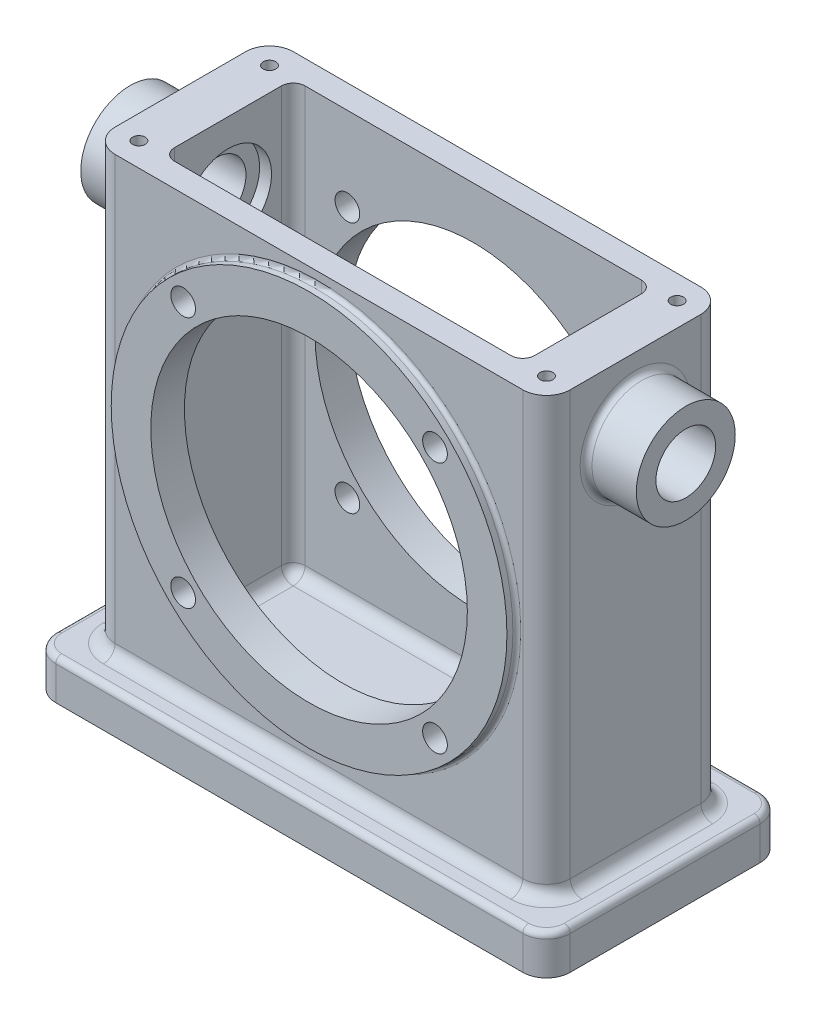
from build123d import *

# Parameters (mm, degrees)
SKETCH1_W           = 130
SKETCH1_H           = 60
BASE_EXTRUDE_DEPTH  = 10
SKETCH2_W           = 115
SKETCH2_H           = 45
BOSS_EXTRUDE1_DEPTH = 110
FILLET1_R           = 6
FILLET2_R           = 1.5
FILLET3_R           = 3
CUT_EXTRUDE1_DEPTH  = 107.95
FILLET4_R           = 3
SKETCH4_R           = 50
BOSS_EXTRUDE2_DEPTH = 2.5
SKETCH5_R           = 40
CUT_EXTRUDE2_DEPTH  = 148.13938974
FILLET5_R           = 1
SKETCH6_R           = 12.5
BOSS_EXTRUDE3_DEPTH = 12.7
SKETCH7_R           = 7.55
CUT_EXTRUDE3_DEPTH  = 166.862141618
SKETCH8_R           = 11
CUT_EXTRUDE4_DEPTH  = 3
FILLET6_R           = 1.5
SKETCH9_R           = 3.125
CUT_EXTRUDE5_DEPTH  = 150.509330812
CIRPATTERN1_COUNT   = 4
SKETCH10_R          = 1.6
CUT_EXTRUDE6_DEPTH  = 19.05


with BuildPart() as part:
    # Sketch1 → Base-Extrude (new body)
    with BuildSketch(Plane(origin=(0, 0, 0), x_dir=(1, 0, 0), z_dir=(0, 1, 0))):
        Rectangle(SKETCH1_W, SKETCH1_H)
    extrude(amount=BASE_EXTRUDE_DEPTH)

    # Sketch2 → Boss-Extrude1 (add)
    with BuildSketch(Plane(origin=(0, 10, 0), x_dir=(-1, 0, 0), z_dir=(0, 1, 0))):
        Rectangle(SKETCH2_W, SKETCH2_H)
    extrude(amount=BOSS_EXTRUDE1_DEPTH)

    # Fillet1
    fillet1_edges = [part.edges().sort_by_distance(p)[0] for p in [
        (-57.5, 65, -22.5),
        (-57.5, 65, 22.5),
        (57.5, 65, 22.5),
        (57.5, 65, -22.5),
        (-65, 5, -30),
        (65, 5, -30),
        (65, 5, 30),
        (-65, 5, 30),
    ]]
    fillet(fillet1_edges, radius=FILLET1_R)

    # Fillet2
    fillet2_edges = [part.edges().sort_by_distance(p)[0] for p in [
        (0, 10, 30),
        (-65, 10, 0),
        (65, 10, 0),
        (0, 10, -30),
        (-63.242640687, 10, -28.242640687),
        (63.242640687, 10, 28.242640687),
        (63.242640687, 10, -28.242640687),
        (-63.242640687, 10, 28.242640687),
    ]]
    fillet(fillet2_edges, radius=FILLET2_R)

    # Fillet3
    fillet3_edges = [part.edges().sort_by_distance(p)[0] for p in [
        (-57.5, 10, 0),
        (0, 10, -22.5),
        (57.5, 10, 0),
        (0, 10, 22.5),
        (-55.742640687, 10, 20.742640687),
        (-55.742640687, 10, -20.742640687),
        (55.742640687, 10, 20.742640687),
        (55.742640687, 10, -20.742640687),
    ]]
    fillet(fillet3_edges, radius=FILLET3_R)

    # Sketch3 → Cut-Extrude1 (cut)
    with BuildSketch(Plane(origin=(0, 120, 0), x_dir=(-1, 0, 0), z_dir=(0, 1, 0))):
        with BuildLine():
            Line((42.5, 16.5), (-42.5, 16.5))
            ThreePointArc((-42.5, 16.5), (-44.621320344, 15.621320344), (-45.5, 13.5))
            Line((-45.5, 13.5), (-45.5, -13.5))
            ThreePointArc((-45.5, -13.5), (-44.621320344, -15.621320344), (-42.5, -16.5))
            Line((-42.5, -16.5), (42.5, -16.5))
            ThreePointArc((42.5, -16.5), (44.621320344, -15.621320344), (45.5, -13.5))
            Line((45.5, -13.5), (45.5, 13.5))
            ThreePointArc((45.5, 13.5), (44.621320344, 15.621320344), (42.5, 16.5))
        make_face()
    extrude(amount=-CUT_EXTRUDE1_DEPTH, mode=Mode.SUBTRACT)

    # Fillet4
    fillet4_edges = [part.edges().sort_by_distance(p)[0] for p in [
        (44.621320344, 12.05, 15.621320344),
        (0, 12.05, 16.5),
        (-44.621320344, 12.05, 15.621320344),
        (-45.5, 12.05, 0),
        (-44.621320344, 12.05, -15.621320344),
        (0, 12.05, -16.5),
        (44.621320344, 12.05, -15.621320344),
        (45.5, 12.05, 0),
    ]]
    fillet(fillet4_edges, radius=FILLET4_R)

    # Sketch4 → Boss-Extrude2 (add)
    with BuildSketch(Plane.XY.offset(22.5)):
        with Locations(Location((0, 67, 0), (0, 0, 180))):
            Circle(SKETCH4_R)
    boss_extrude2 = extrude(amount=BOSS_EXTRUDE2_DEPTH)

    # Mirror1: Boss-Extrude2 across plane
    add(boss_extrude2.mirror(Plane.XY))

    # Sketch5 → Cut-Extrude2 (cut, through all)
    with BuildSketch(Plane.XY.offset(25)):
        with Locations(Location((0, 67, 0), (0, 0, 180))):
            Circle(SKETCH5_R)
    extrude(amount=-CUT_EXTRUDE2_DEPTH, mode=Mode.SUBTRACT)

    # Fillet5
    fillet5_edges = [part.edges().sort_by_distance(p)[0] for p in [
        (50, 67, 22.5),
        (50, 67, -22.5),
    ]]
    fillet(fillet5_edges, radius=FILLET5_R)

    # Sketch6 → Boss-Extrude3 (add)
    with BuildSketch(Plane(origin=(57.5, 0, 0), x_dir=(0, 0, -1), z_dir=(1, 0, 0))):
        with Locations(Location((0, 102, 0), (0, 0, 180))):
            Circle(SKETCH6_R)
    boss_extrude3 = extrude(amount=BOSS_EXTRUDE3_DEPTH)

    # Sketch7 → Cut-Extrude3 (cut, through all)
    with BuildSketch(Plane.ZY.offset(-45.5)):
        with Locations((0, 102)):
            Circle(SKETCH7_R)
    cut_extrude3 = extrude(amount=-CUT_EXTRUDE3_DEPTH, mode=Mode.SUBTRACT)

    # Sketch8 → Cut-Extrude4 (cut)
    with BuildSketch(Plane.ZY.offset(-45.5)):
        with Locations((0, 102)):
            Circle(SKETCH8_R)
    cut_extrude4 = extrude(amount=-CUT_EXTRUDE4_DEPTH, mode=Mode.SUBTRACT)

    # Mirror3: Boss-Extrude3, Cut-Extrude3, Cut-Extrude4 across plane
    add(boss_extrude3.mirror(Plane(origin=(0, 0, 0), x_dir=(0, 0, 1), z_dir=(1, 0, 0))))
    add(cut_extrude3.mirror(Plane(origin=(0, 0, 0), x_dir=(0, 0, 1), z_dir=(1, 0, 0))), mode=Mode.SUBTRACT)
    add(cut_extrude4.mirror(Plane(origin=(0, 0, 0), x_dir=(0, 0, 1), z_dir=(1, 0, 0))), mode=Mode.SUBTRACT)

    # Fillet6
    fillet6_edges = [part.edges().sort_by_distance(p)[0] for p in [
        (57.5, 102, -12.5),
        (-57.5, 102, -12.5),
    ]]
    fillet(fillet6_edges, radius=FILLET6_R)

    # Sketch9 → Cut-Extrude5 (cut, through all)
    with BuildSketch(Plane.XY.offset(25)):
        with Locations(Location((31.819805153, 98.819805153, 0), (0, 0, 180))):
            Circle(SKETCH9_R)
    cut_extrude5 = extrude(amount=-CUT_EXTRUDE5_DEPTH, mode=Mode.SUBTRACT)

    # CirPattern1: Cut-Extrude5 ×4 about axis
    cirpattern1_axis = Axis((0, 67, 0), (0, 0, 1))
    for i in range(1, CIRPATTERN1_COUNT):
        add(cut_extrude5.rotate(cirpattern1_axis, i * 360 / CIRPATTERN1_COUNT), mode=Mode.SUBTRACT)

    # Sketch10 → Cut-Extrude6 (cut)
    with BuildSketch(Plane(origin=(0, 120, 0), x_dir=(-1, 0, 0), z_dir=(0, 1, 0))):
        with Locations(Location((-51.5, -16.5, 0), (0, 0, 90))):
            Circle(SKETCH10_R)
        with Locations(Location((-51.5, 16.5, 0), (0, 0, 90))):
            Circle(SKETCH10_R)
    cut_extrude6 = extrude(amount=-CUT_EXTRUDE6_DEPTH, mode=Mode.SUBTRACT)

    # Mirror4: Cut-Extrude6 across plane
    add(cut_extrude6.mirror(Plane(origin=(0, 0, 0), x_dir=(0, 0, 1), z_dir=(1, 0, 0))), mode=Mode.SUBTRACT)


solid = part.part
